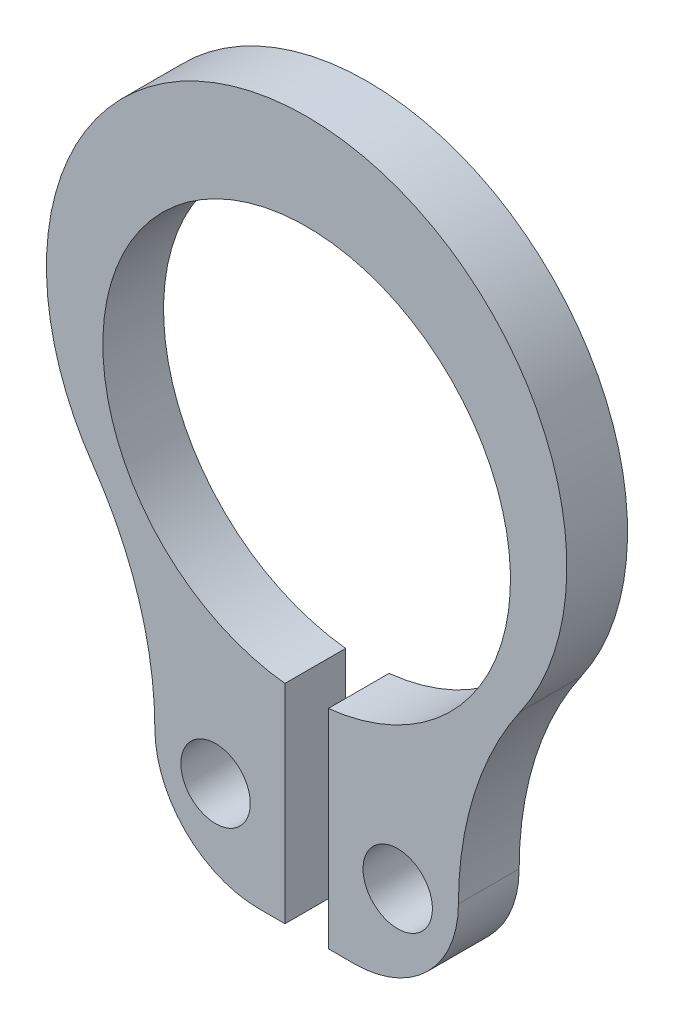
from build123d import *

# Parameters (mm, degrees)
SKETCH_1_R      = 0.4
EXTRUDE_1_DEPTH = 0.7


with BuildPart() as part:
    # 草图1 → 凸台-拉伸1 (new body)
    with BuildSketch(Plane.XY):
        with BuildLine():
            Line((-0.25, -2.336664289), (-0.25, -4.736664289))
            Line((-0.25, -4.736664289), (-0.55, -4.736664289))
            ThreePointArc((-0.55, -4.736664289), (-1.398077663, -4.385642662), (-1.749999324, -3.537938086))
            ThreePointArc((-1.749999324, -3.537938086), (-1.933378352, -2.344928231), (-2.464284459, -1.260936032))
            ThreePointArc((-2.464284459, -1.260936032), (0, 3.45), (2.464284459, -1.260936032))
            ThreePointArc((2.464284459, -1.260936032), (1.933378352, -2.344928231), (1.749999324, -3.537938086))
            ThreePointArc((1.749999324, -3.537938086), (1.398077663, -4.385642662), (0.55, -4.736664289))
            Line((0.55, -4.736664289), (0.25, -4.736664289))
            Line((0.25, -4.736664289), (0.25, -2.336664289))
            ThreePointArc((0.25, -2.336664289), (0, 2.35), (-0.25, -2.336664289))
        make_face()
        with Locations(Location((-1.05, -3.736664289, 0), (0, 0, 180))):
            Circle(SKETCH_1_R, mode=Mode.SUBTRACT)
        with Locations((1.05, -3.736664289)):
            Circle(SKETCH_1_R, mode=Mode.SUBTRACT)
    extrude(amount=EXTRUDE_1_DEPTH)


solid = part.part
